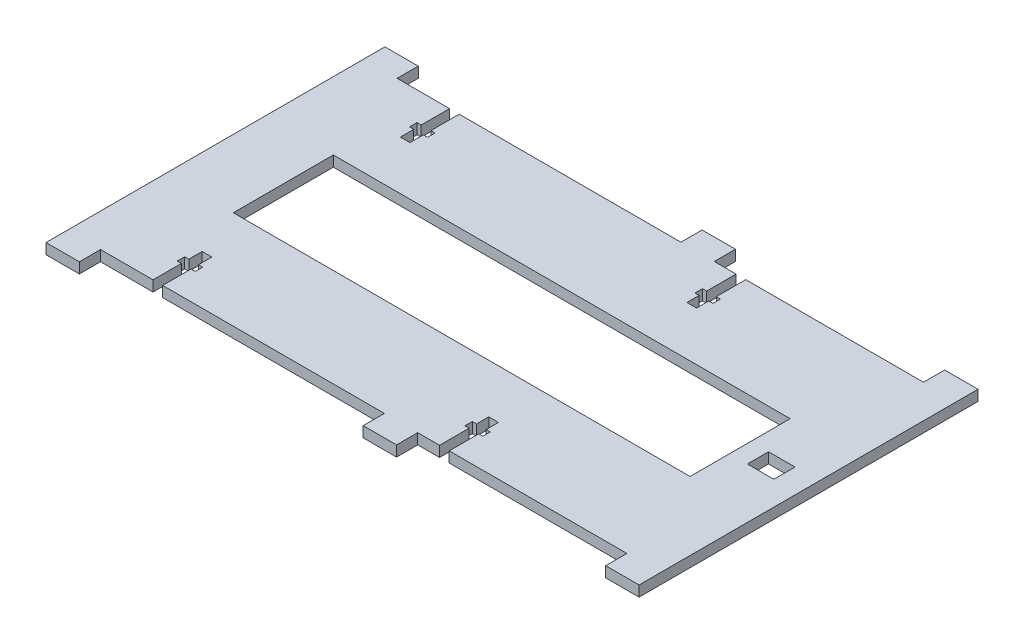
from build123d import *

# Parameters (mm, degrees)
SKETCH1_W      = 136.944523068
SKETCH1_H      = 30
SKETCH1_W_2    = 7.9375
SKETCH1_H_2    = 6.35
EXTRUDE1_DEPTH = 3.175


with BuildPart() as part:
    # Sketch1 → Extrude1 (new body)
    with BuildSketch(Plane(origin=(0, 0, 0), x_dir=(1, 0, 0), z_dir=(0, 1, 0))):
        Polygon((-67.158636898, 70.484310302), (-67.158636898, 74.492800404), (-68.408636898, 74.492800404), (-68.408636898, 76.742800404), (-67.158636898, 76.742800404), (-67.158636898, 85.234310302), (-82.88813161, 85.234310302), (-82.88813161, 91.584310302), (-92.88813161, 91.584310302), (-92.88813161, -10.015689698), (-82.88813161, -10.015689698), (-82.88813161, -3.665689698), (-67.158636898, -3.665689698), (-67.158636898, 4.825820201), (-68.408636898, 4.825820201), (-68.408636898, 7.075820201), (-67.158636898, 7.075820201), (-67.158636898, 11.084310302), (-64.258636898, 11.084310302), (-64.258636898, 7.075820201), (-63.008636898, 7.075820201), (-63.008636898, 4.825820201), (-64.258636898, 4.825820201), (-64.258636898, -3.665689698), (2.20186839, -3.665689698), (2.20186839, -10.015689698), (12.20186839, -10.015689698), (12.20186839, -3.665689698), (18.744143558, -3.665689698), (18.744143558, 5.171032224), (17.494143558, 5.171032224), (17.494143558, 7.421032224), (18.744143558, 7.421032224), (18.744143558, 11.084310302), (21.644143558, 11.084310302), (21.644143558, 7.421032224), (22.894143558, 7.421032224), (22.894143558, 5.171032224), (21.644143558, 5.171032224), (21.644143558, -3.665689698), (74.914143558, -3.665689698), (74.914143558, -10.015689698), (84.914143558, -10.015689698), (84.914143558, 91.584310302), (74.914143558, 91.584310302), (74.914143558, 85.234310302), (21.644143558, 85.234310302), (21.644143558, 76.397588381), (22.894143558, 76.397588381), (22.894143558, 74.147588381), (21.644143558, 74.147588381), (21.644143558, 70.484310302), (18.744143558, 70.484310302), (18.744143558, 74.147588381), (17.494143558, 74.147588381), (17.494143558, 76.397588381), (18.744143558, 76.397588381), (18.744143558, 85.234310302), (12.20186839, 85.234310302), (12.20186839, 91.584310302), (2.20186839, 91.584310302), (2.20186839, 85.234310302), (-64.258636898, 85.234310302), (-64.258636898, 76.742800404), (-63.008636898, 76.742800404), (-63.008636898, 74.492800404), (-64.258636898, 74.492800404), (-64.258636898, 70.484310302), align=None)
        with Locations((-4.072635431, 40.784310302)):
            Rectangle(SKETCH1_W, SKETCH1_H, mode=Mode.SUBTRACT)
        with Locations((73.709900913, 40.784310302)):
            Rectangle(SKETCH1_W_2, SKETCH1_H_2, mode=Mode.SUBTRACT)
    extrude(amount=EXTRUDE1_DEPTH)


solid = part.part
